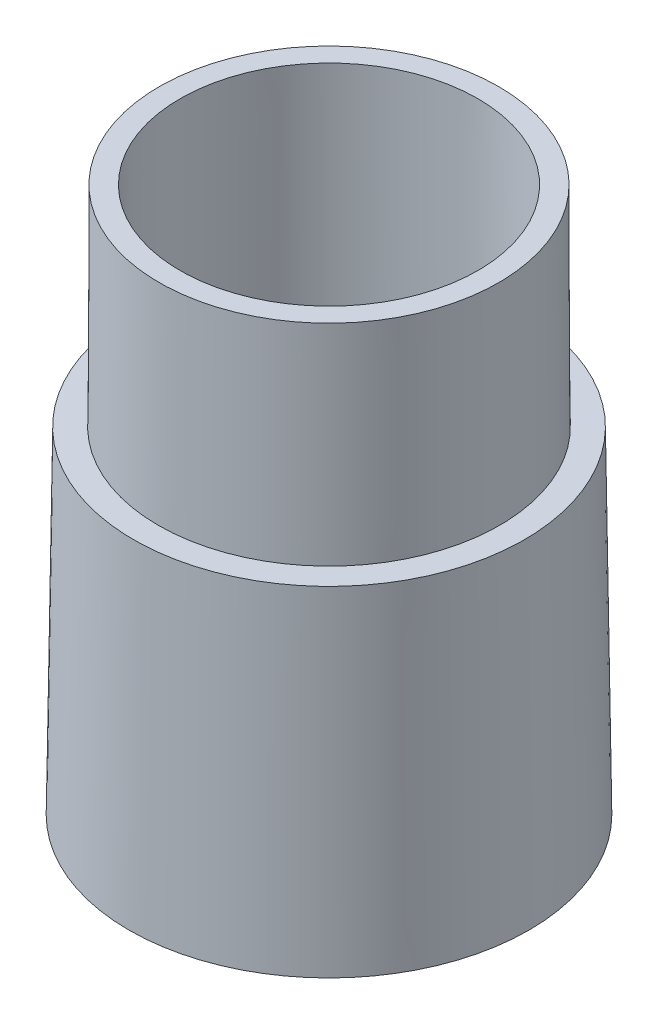
from build123d import *

# Parameters (mm, degrees)
SKETCH2_R         = 0.25
CIRPATTERN1_COUNT = 4


with BuildPart() as part:
    # Sketch1 → Revolve1 (revolve)
    with BuildSketch(Plane(origin=(0, 0, 0), x_dir=(0, 0, -1), z_dir=(1, 0, 0)), mode=Mode.PRIVATE) as revolve1_sk:
        Polygon((-9.925, 0), (-9.7, 16.67), (-8.47, 16.67), (-8.425, 27.08), (-7.39, 27.08), (-7.485, 14.68), (-8.611859628, 14.68), (-8.81, 0), align=None)
    revolve(revolve1_sk.sketch.rotate(Axis((0, 0, 0), (0, 1, 0)), 180), axis=Axis((0, 0, 0), (0, 1, 0)))

    # Sweep1: sweep along a path in Sketch3
    with BuildLine(Plane(origin=(0, 0, 0), x_dir=(0, 0, -1), z_dir=(1, 0, 0))) as sweep1_path:
        Line((8.81, 0), (8.611859628, 14.68))
    # Sketch2 → Sweep1 (sweep)
    with BuildSketch(Plane.XZ):
        with Locations((0, -8.81)):
            Circle(SKETCH2_R)
    sweep1 = sweep(path=sweep1_path.line)

    # CirPattern1: Sweep1 ×4 about axis
    cirpattern1_axis = Axis((0, 0, 0), (0, -1, 0))
    for i in range(1, CIRPATTERN1_COUNT):
        add(sweep1.rotate(cirpattern1_axis, i * 360 / CIRPATTERN1_COUNT))


solid = part.part
